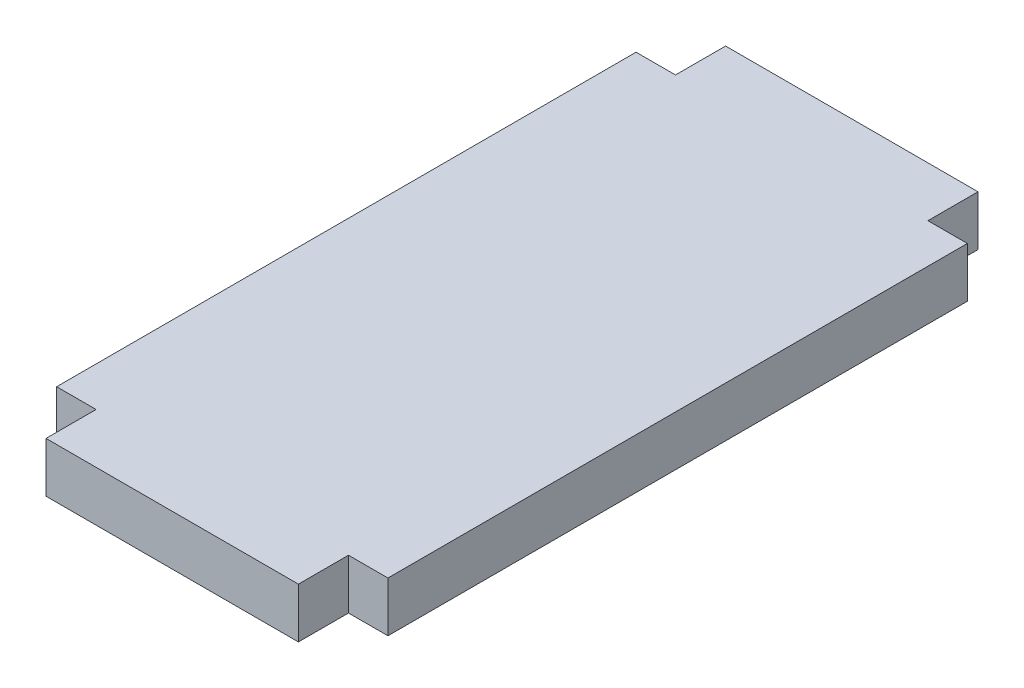
from build123d import *

# Parameters (mm, degrees)
SKETCH1_W           = 2.5
SKETCH1_H           = 36.73
SKETCH1_W_2         = 16
SKETCH1_H_2         = 3.175
BOSS_EXTRUDE1_DEPTH = 3.175


with BuildPart() as part:
    # Sketch1 → Boss-Extrude1 (new body)
    with BuildSketch(Plane(origin=(0, 0, 0), x_dir=(1, 0, 0), z_dir=(0, 1, 0))):
        with Locations((-9.25, 0)):
            Rectangle(SKETCH1_W, SKETCH1_H)
        Rectangle(SKETCH1_W_2, SKETCH1_H)
        with Locations((9.25, 0)):
            Rectangle(SKETCH1_W, SKETCH1_H)
        with Locations((0, -19.9525)):
            Rectangle(SKETCH1_W_2, SKETCH1_H_2)
        with Locations((0, 19.9525)):
            Rectangle(SKETCH1_W_2, SKETCH1_H_2)
    extrude(amount=BOSS_EXTRUDE1_DEPTH)


solid = part.part
